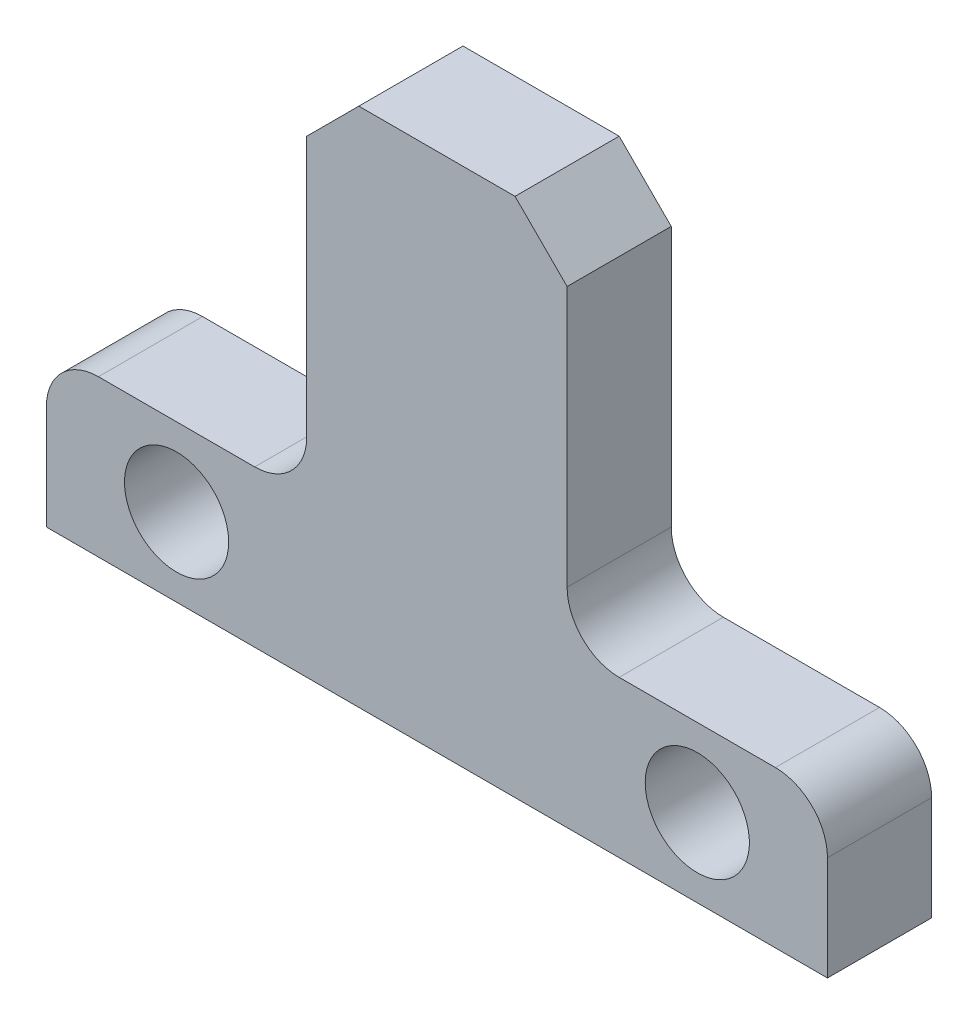
from build123d import *

# Parameters (mm, degrees)
SKETCH1_R           = 10
BOSS_EXTRUDE1_DEPTH = 20


with BuildPart() as part:
    # Sketch1 → Boss-Extrude1 (new body)
    with BuildSketch(Plane.XY):
        with BuildLine():
            Line((-75, 0), (75, 0))
            Line((75, 0), (75, 20))
            ThreePointArc((75, 20), (72.071067812, 27.071067812), (65, 30))
            Line((65, 30), (35, 30))
            ThreePointArc((35, 30), (27.928932188, 32.928932188), (25, 40))
            Line((25, 40), (25, 90))
            Line((25, 90), (15, 100))
            Line((15, 100), (-15, 100))
            Line((-15, 100), (-25, 90))
            Line((-25, 90), (-25, 40))
            ThreePointArc((-25, 40), (-27.928932188, 32.928932188), (-35, 30))
            Line((-35, 30), (-65, 30))
            ThreePointArc((-65, 30), (-72.071067812, 27.071067812), (-75, 20))
            Line((-75, 20), (-75, 0))
        make_face()
        with Locations((-50, 15)):
            Circle(SKETCH1_R, mode=Mode.SUBTRACT)
        with Locations(Location((50, 15, 0), (0, 0, 180))):
            Circle(SKETCH1_R, mode=Mode.SUBTRACT)
    extrude(amount=BOSS_EXTRUDE1_DEPTH)


solid = part.part
